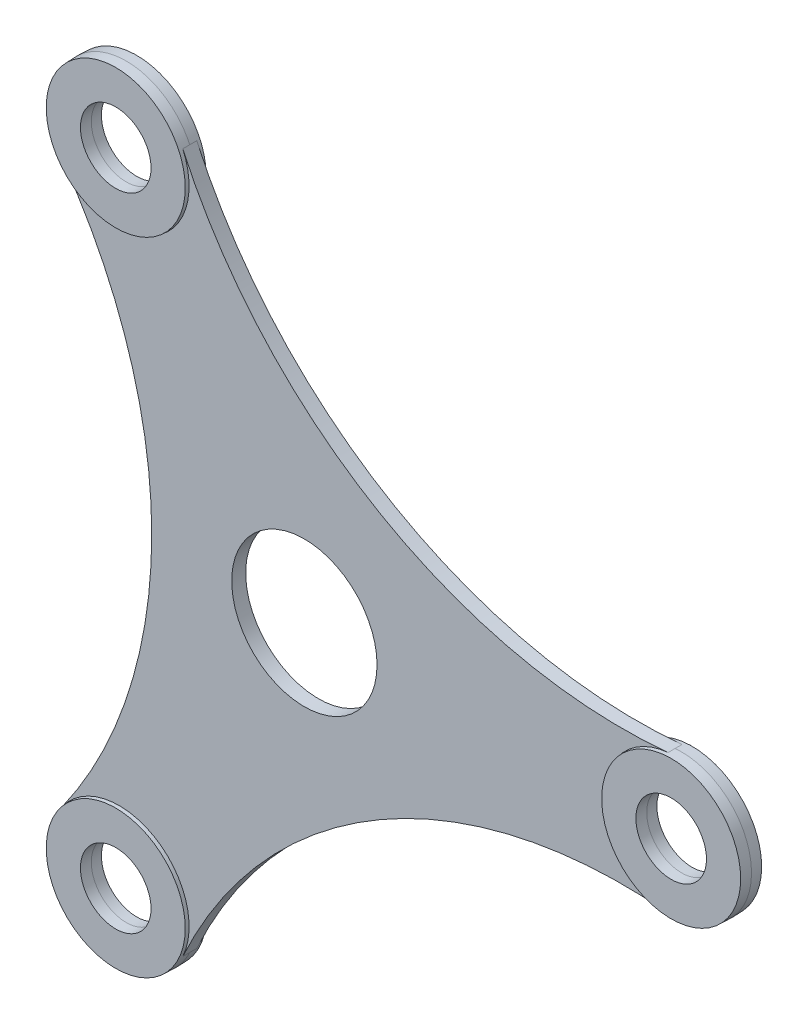
from build123d import *

# Parameters (mm, degrees)
SKETCH1_R                     = 52
BOSS_EXTRUDE1_DEPTH           = 5
SKETCH1_3_R                   = 50
SKETCH1_3_R_2                 = 25
BOSS_EXTRUDE2_DEPTH           = 7.5
BOSS_EXTRUDE2_TAPER           = 2
BOSS_EXTRUDE2_OTHER_WAY_DEPTH = 7.5
BOSS_EXTRUDE2_OTHER_WAY_TAPER = 2


with BuildPart() as part:
    # Sketch1 → Boss-Extrude1 (new, symmetric)
    with BuildSketch(Plane.XY):
        with BuildLine():
            ThreePointArc((260.255645268, -49.776958244), (214.973105174, 0), (260.255645268, 49.776958244))
            ThreePointArc((260.255645268, 49.776958244), (54.610822714, 94.588719583), (-87.019712271, 250.276479402))
            ThreePointArc((-87.019712271, 250.276479402), (-83.632985595, 240.119049454), (-82.486552587, 229.473440401))
            ThreePointArc((-82.486552587, 229.473440401), (-117.279136969, 181.842205793), (-173.235932996, 200.499521158))
            ThreePointArc((-173.235932996, 200.499521158), (-109.221645428, 0), (-173.235932996, -200.499521158))
            ThreePointArc((-173.235932996, -200.499521158), (-117.279136969, -181.842205793), (-82.486552587, -229.473440401))
            ThreePointArc((-82.486552587, -229.473440401), (-83.632985595, -240.119049454), (-87.019712271, -250.276479402))
            ThreePointArc((-87.019712271, -250.276479402), (54.610822714, -94.588719583), (260.255645268, -49.776958244))
        make_face()
        Circle(SKETCH1_R, mode=Mode.SUBTRACT)
    extrude(amount=BOSS_EXTRUDE1_DEPTH, both=True)



with BuildPart() as body_2:
    # Sketch1<3> → Boss-Extrude2 (new body)
    # profile 1 of 3: a face of its own
    with BuildSketch(Plane.XY):
        with Locations((-132.486552587, 229.473440401)):
            Circle(SKETCH1_3_R)
        with Locations((-132.486552587, 229.473440401)):
            Circle(SKETCH1_3_R_2, mode=Mode.SUBTRACT)
    # profile 2 of 3: a face of its own
    with BuildSketch(Plane.XY):
        with Locations((-132.486552587, -229.473440401)):
            Circle(SKETCH1_3_R)
        with Locations((-132.486552587, -229.473440401)):
            Circle(SKETCH1_3_R_2, mode=Mode.SUBTRACT)
    # profile 3 of 3: a face of its own
    with BuildSketch(Plane.XY):
        with Locations((264.973105174, 0)):
            Circle(SKETCH1_3_R)
        with Locations((264.973105174, 0)):
            Circle(SKETCH1_3_R_2, mode=Mode.SUBTRACT)
    extrude(amount=BOSS_EXTRUDE2_DEPTH, taper=BOSS_EXTRUDE2_TAPER)


with BuildPart() as part_1:
    add(part.part)

    add(body_2.part)  # Boss-Extrude2 other way merges body 2
    # Sketch1<3> → Boss-Extrude2 other way (add)
    # profile 1 of 3: a face of its own
    with BuildSketch(Plane.XY):
        with Locations((-132.486552587, 229.473440401)):
            Circle(SKETCH1_3_R)
        with Locations((-132.486552587, 229.473440401)):
            Circle(SKETCH1_3_R_2, mode=Mode.SUBTRACT)
    # profile 2 of 3: a face of its own
    with BuildSketch(Plane.XY):
        with Locations((-132.486552587, -229.473440401)):
            Circle(SKETCH1_3_R)
        with Locations((-132.486552587, -229.473440401)):
            Circle(SKETCH1_3_R_2, mode=Mode.SUBTRACT)
    # profile 3 of 3: a face of its own
    with BuildSketch(Plane.XY):
        with Locations((264.973105174, 0)):
            Circle(SKETCH1_3_R)
        with Locations((264.973105174, 0)):
            Circle(SKETCH1_3_R_2, mode=Mode.SUBTRACT)
    extrude(amount=-BOSS_EXTRUDE2_OTHER_WAY_DEPTH, taper=BOSS_EXTRUDE2_OTHER_WAY_TAPER)


solid = part_1.part
